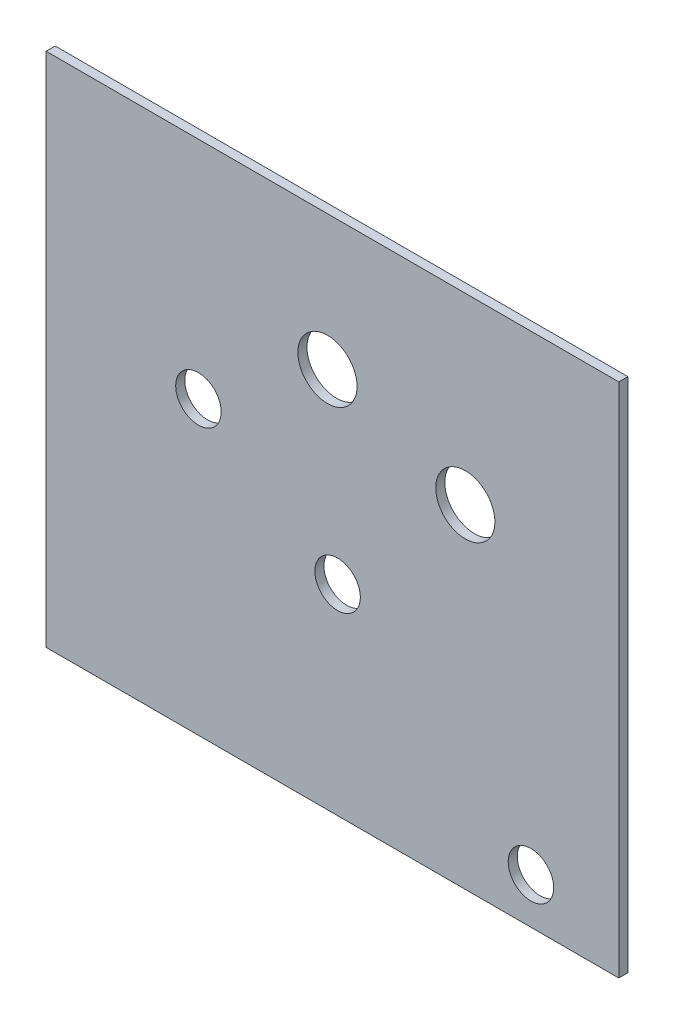
from build123d import *

# Parameters (mm, degrees)
SKETCH1_W                               = 125.870370198
SKETCH1_H                               = 113.481751874
BOSS_EXTRUDE1_DEPTH                     = 2
CBORE_FOR_M5_HEX_HEAD_BOLT1_D           = 5.5
CBORE_FOR_M5_HEX_HEAD_BOLT1_CBORE_D     = 13
CBORE_FOR_M5_HEX_HEAD_BOLT1_CBORE_DEPTH = 3.5
SKETCH4_R                               = 5
CUT_EXTRUDE1_DEPTH                      = 2


with BuildPart() as part:
    # Sketch1 → Boss-Extrude1 (new body)
    with BuildSketch(Plane.XY):
        with Locations((-62.935185099, 56.740875937)):
            Rectangle(SKETCH1_W, SKETCH1_H)
    extrude(amount=BOSS_EXTRUDE1_DEPTH)

    # CBORE for M5 Hex Head Bolt1 (through all)
    with Locations(Plane(origin=(0, 0, 0), x_dir=(-1, 0, 0), z_dir=(0, 0, -1))):
        with Locations((33.729629401, 73.217807093), (64.028441194, 83.838009165)):
            CounterBoreHole(CBORE_FOR_M5_HEX_HEAD_BOLT1_D / 2, CBORE_FOR_M5_HEX_HEAD_BOLT1_CBORE_D / 2, CBORE_FOR_M5_HEX_HEAD_BOLT1_CBORE_DEPTH)

    # Sketch4 → Cut-Extrude1 (cut)
    with BuildSketch(Plane(origin=(0, 0, 0), x_dir=(-1, 0, 0), z_dir=(0, 0, -1))):
        with Locations((19.304896116, 10)):
            Circle(SKETCH4_R)
        with Locations((61.810693115, 44.050073834)):
            Circle(SKETCH4_R)
        with Locations((92.396875082, 64.050073834)):
            Circle(SKETCH4_R)
    extrude(amount=-CUT_EXTRUDE1_DEPTH, mode=Mode.SUBTRACT)


solid = part.part
